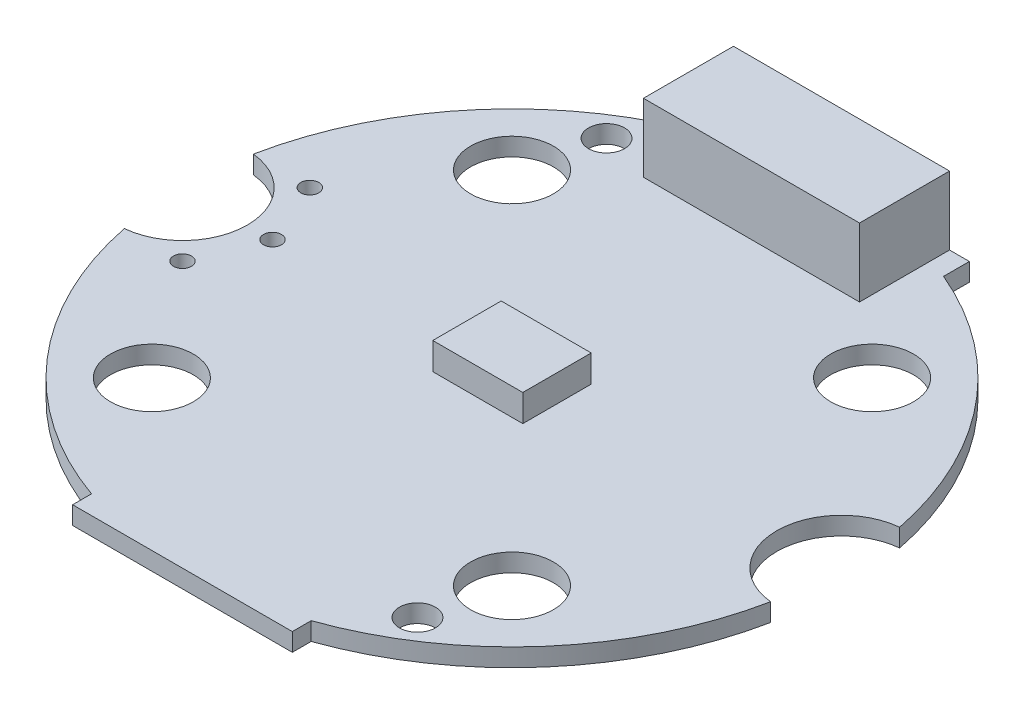
from build123d import *

# Parameters (mm, degrees)
SKETCH1_R           = 2.3
EXTRUDE1_DEPTH      = 1
SKETCH2_W           = 12
SKETCH2_H           = 5
EXTRUDE2_DEPTH      = 3.8
SKETCH3_W           = 5
SKETCH3_H           = 3.8
EXTRUDE3_DEPTH      = 1.5
SKETCH4_W           = 6
SKETCH4_H           = 7.1
EXTRUDE4_DEPTH      = 2
EXTRUDE5_DEPTH      = 26.91110545
EXTRUDE5_DEPTH_BACK = 26.91110545
SKETCH5_R           = 1
SKETCH6_R           = 0.5
EXTRUDE6_DEPTH      = 27.076529402


with BuildPart() as part:
    # Sketch1 → Extrude1 (new body)
    with BuildSketch(Plane(origin=(0, 0, 0), x_dir=(1, 0, 0), z_dir=(0, 1, 0))):
        with BuildLine():
            Line((-7.1, 18.3), (-7.1, 16.866534914))
            ThreePointArc((-7.1, 16.866534914), (-14.175345058, 11.573659425), (-17.945901639, 3.582543001))
            ThreePointArc((-17.945901639, 3.582543001), (-14.7, 0), (-17.945901639, -3.582543001))
            ThreePointArc((-17.945901639, -3.582543001), (-13.830201246, -11.983969855), (-6.1, -17.253405461))
            Line((-6.1, -17.253405461), (-6.1, -18.3))
            Line((-6.1, -18.3), (6.1, -18.3))
            Line((6.1, -18.3), (6.1, -17.253405461))
            ThreePointArc((6.1, -17.253405461), (13.830201246, -11.983969855), (17.945901639, -3.582543001))
            ThreePointArc((17.945901639, -3.582543001), (14.7, 0), (17.945901639, 3.582543001))
            ThreePointArc((17.945901639, 3.582543001), (14.175345058, 11.573659425), (7.1, 16.866534914))
            Line((7.1, 16.866534914), (7.1, 18.3))
            Line((7.1, 18.3), (-7.1, 18.3))
        make_face()
        with Locations((-10, 10)):
            Circle(SKETCH1_R, mode=Mode.SUBTRACT)
        with Locations((10, 10)):
            Circle(SKETCH1_R, mode=Mode.SUBTRACT)
        with Locations((10, -10)):
            Circle(SKETCH1_R, mode=Mode.SUBTRACT)
        with Locations((-10, -10)):
            Circle(SKETCH1_R, mode=Mode.SUBTRACT)
    extrude(amount=EXTRUDE1_DEPTH)

    # Sketch2 → Extrude2 (add)
    with BuildSketch(Plane(origin=(0, 1, 0), x_dir=(1, 0, 0), z_dir=(0, 1, 0))):
        with Locations((0, 15.8)):
            Rectangle(SKETCH2_W, SKETCH2_H)
    extrude(amount=EXTRUDE2_DEPTH)

    # Sketch3 → Extrude3 (add)
    with BuildSketch(Plane(origin=(0, 1, 0), x_dir=(1, 0, 0), z_dir=(0, 1, 0))):
        Rectangle(SKETCH3_W, SKETCH3_H)
    extrude(amount=EXTRUDE3_DEPTH)

    # Sketch4 → Extrude4 (add)
    with BuildSketch(Plane.XZ):
        with Locations((0, 8.25)):
            Rectangle(SKETCH4_W, SKETCH4_H)
    extrude(amount=EXTRUDE4_DEPTH)

    # Sketch5 → Extrude5 (cut, two sides: drawn at the far end of the back side and taken through both)
    with BuildSketch(Plane(origin=(0, 1, 0), x_dir=(1, 0, 0), z_dir=(0, 1, 0)).offset(-EXTRUDE5_DEPTH_BACK)):
        with Locations((-8.9, 14.15)):
            Circle(SKETCH5_R)
        with Locations((8.9, -14.15)):
            Circle(SKETCH5_R)
    extrude(amount=EXTRUDE5_DEPTH + EXTRUDE5_DEPTH_BACK, mode=Mode.SUBTRACT)

    # Sketch6 → Extrude6 (cut, through all)
    with BuildSketch(Plane.XZ):
        with Locations((-13.3, 0)):
            Circle(SKETCH6_R)
        with Locations((-14.764466094, 3.535533906)):
            Circle(SKETCH6_R)
        with Locations((-14.764466094, -3.535533906)):
            Circle(SKETCH6_R)
    extrude(amount=-EXTRUDE6_DEPTH, mode=Mode.SUBTRACT)


solid = part.part
